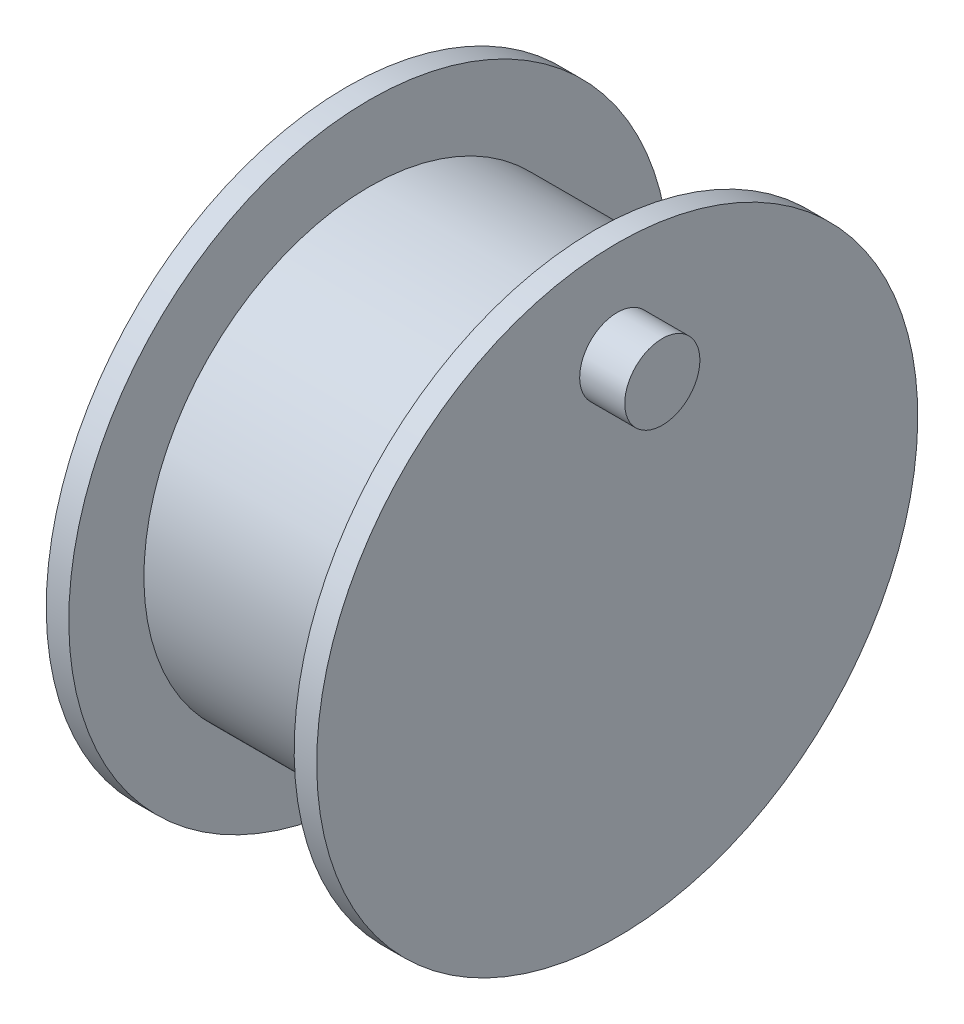
from build123d import *

# Parameters (mm, degrees)
SKETCH6_R           = 2.5
BOSS_EXTRUDE2_DEPTH = 3
SKETCH7_R           = 3
CUT_EXTRUDE2_DEPTH  = 16


with BuildPart() as part:
    # Sketch4 → Revolve1 (revolve)
    with BuildSketch(Plane.XY):
        Polygon((-7.5, 15), (7.5, 15), (7.5, 20), (9, 20), (9, 0), (-9, 0), (-9, 20), (-7.5, 20), align=None)
    revolve(axis=Axis((9, 0, 0), (-1, 0, 0)))

    # Sketch6 → Boss-Extrude2 (add)
    with BuildSketch(Plane(origin=(9, 0, 0), x_dir=(0, 0, -1), z_dir=(1, 0, 0))):
        with Locations(Location((0, 13.5, 0), (0, 0, 90))):
            Circle(SKETCH6_R)
    extrude(amount=BOSS_EXTRUDE2_DEPTH)

    # Sketch7 → Cut-Extrude2 (cut)
    with BuildSketch(Plane.ZY.offset(9)):
        with Locations(Location((0, 0, 0), (0, 0, 270))):
            Circle(SKETCH7_R)
    extrude(amount=-CUT_EXTRUDE2_DEPTH, mode=Mode.SUBTRACT)


solid = part.part
